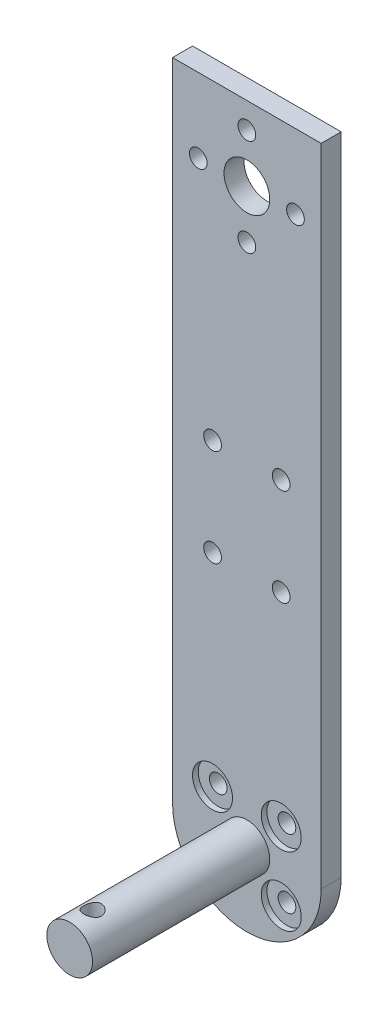
from build123d import *

# Parameters (mm, degrees)
SKETCH1_R                           = 1.55
SKETCH1_R_2                         = 4
BOSS_EXTRUDE1_DEPTH                 = 3.5
SKETCH2_R                           = 4
BOSS_EXTRUDE2_DEPTH                 = 31
SKETCH3_R                           = 3.5
CUT_EXTRUDE1_DEPTH                  = 1
CUT_EXTRUDE2_REACH                  = 120.862
CUT_EXTRUDE2_END_RADIUS             = 4
SKETCH4_R                           = 1.55
CUT_EXTRUDE2_DIRECTION_2_REACH      = 120.862
CUT_EXTRUDE2_DIRECTION_2_END_RADIUS = 4


with BuildPart() as part:
    # Sketch1 → Boss-Extrude1 (new body)
    with BuildSketch(Plane.XY):
        with BuildLine():
            Line((13, 0), (13, 113))
            Line((13, 113), (-13, 113))
            Line((-13, 113), (-13, 0))
            ThreePointArc((-13, 0), (0, -13), (13, 0))
        make_face()
        with Locations((6.01040764, 6.01040764)):
            Circle(SKETCH1_R, mode=Mode.SUBTRACT)
        with Locations((6.01040764, -6.01040764)):
            Circle(SKETCH1_R, mode=Mode.SUBTRACT)
        with Locations((-6.01040764, -6.01040764)):
            Circle(SKETCH1_R, mode=Mode.SUBTRACT)
        with Locations((-6.01040764, 6.01040764)):
            Circle(SKETCH1_R, mode=Mode.SUBTRACT)
        with Locations((0, 100)):
            Circle(SKETCH1_R_2, mode=Mode.SUBTRACT)
        with Locations((0, 108.5)):
            Circle(SKETCH1_R, mode=Mode.SUBTRACT)
        with Locations((8.5, 100)):
            Circle(SKETCH1_R, mode=Mode.SUBTRACT)
        with Locations((0, 91.5)):
            Circle(SKETCH1_R, mode=Mode.SUBTRACT)
        with Locations((-8.5, 100)):
            Circle(SKETCH1_R, mode=Mode.SUBTRACT)
        with Locations((6, 58.5)):
            Circle(SKETCH1_R, mode=Mode.SUBTRACT)
        with Locations((6, 41.5)):
            Circle(SKETCH1_R, mode=Mode.SUBTRACT)
        with Locations((-6, 58.5)):
            Circle(SKETCH1_R, mode=Mode.SUBTRACT)
        with Locations((-6, 41.5)):
            Circle(SKETCH1_R, mode=Mode.SUBTRACT)
    extrude(amount=BOSS_EXTRUDE1_DEPTH)

    # Sketch2 → Boss-Extrude2 (add)
    with BuildSketch(Plane.XY.offset(3.5)):
        Circle(SKETCH2_R)
    extrude(amount=BOSS_EXTRUDE2_DEPTH)

    # Sketch3 → Cut-Extrude1 (cut)
    with BuildSketch(Plane.XY.offset(3.5)):
        with Locations((-6.01040764, 6.01040764)):
            Circle(SKETCH3_R)
        with Locations((6.01040764, 6.01040764)):
            Circle(SKETCH3_R)
        with Locations((6.01040764, -6.01040764)):
            Circle(SKETCH3_R)
        with Locations((-6.01040764, -6.01040764)):
            Circle(SKETCH3_R)
    extrude(amount=-CUT_EXTRUDE1_DEPTH, mode=Mode.SUBTRACT)

    # Cut-Extrude2: up to this cylinder (the profile starts inside it)
    cut_extrude2_end = Plane(origin=(0, 0, 30.5), z_dir=(0, 0, -1)) * Cylinder(CUT_EXTRUDE2_END_RADIUS, 250.724, mode=Mode.PRIVATE)
    # Sketch4 → Cut-Extrude2 (cut, up to the surface)
    with BuildSketch(Plane(origin=(0, 0, 0), x_dir=(0, 0, -1), z_dir=(0, -1, 0)), mode=Mode.PRIVATE) as cut_extrude2_sk1:
        with Locations((-30.5, 0)):
            Circle(SKETCH4_R)
    cut_extrude2_tool1 = extrude(cut_extrude2_sk1.sketch, amount=-CUT_EXTRUDE2_REACH, mode=Mode.PRIVATE) & cut_extrude2_end
    add(cut_extrude2_tool1.solids().sort_by_distance((0, 0, 30.5))[0], mode=Mode.SUBTRACT)

    # Cut-Extrude2 direction 2: up to this cylinder (the profile starts inside it)
    cut_extrude2_direction_2_end = Plane(origin=(0, 0, 30.5), z_dir=(0, 0, -1)) * Cylinder(CUT_EXTRUDE2_DIRECTION_2_END_RADIUS, 250.724, mode=Mode.PRIVATE)
    # Sketch4 → Cut-Extrude2 direction 2 (cut, up to the surface)
    with BuildSketch(Plane(origin=(0, 0, 0), x_dir=(0, 0, -1), z_dir=(0, -1, 0)), mode=Mode.PRIVATE) as cut_extrude2_direction_2_sk1:
        with Locations((-30.5, 0)):
            Circle(SKETCH4_R)
    cut_extrude2_direction_2_tool1 = extrude(cut_extrude2_direction_2_sk1.sketch, amount=CUT_EXTRUDE2_DIRECTION_2_REACH, mode=Mode.PRIVATE) & cut_extrude2_direction_2_end
    add(cut_extrude2_direction_2_tool1.solids().sort_by_distance((0, 0, 30.5))[0], mode=Mode.SUBTRACT)


solid = part.part
